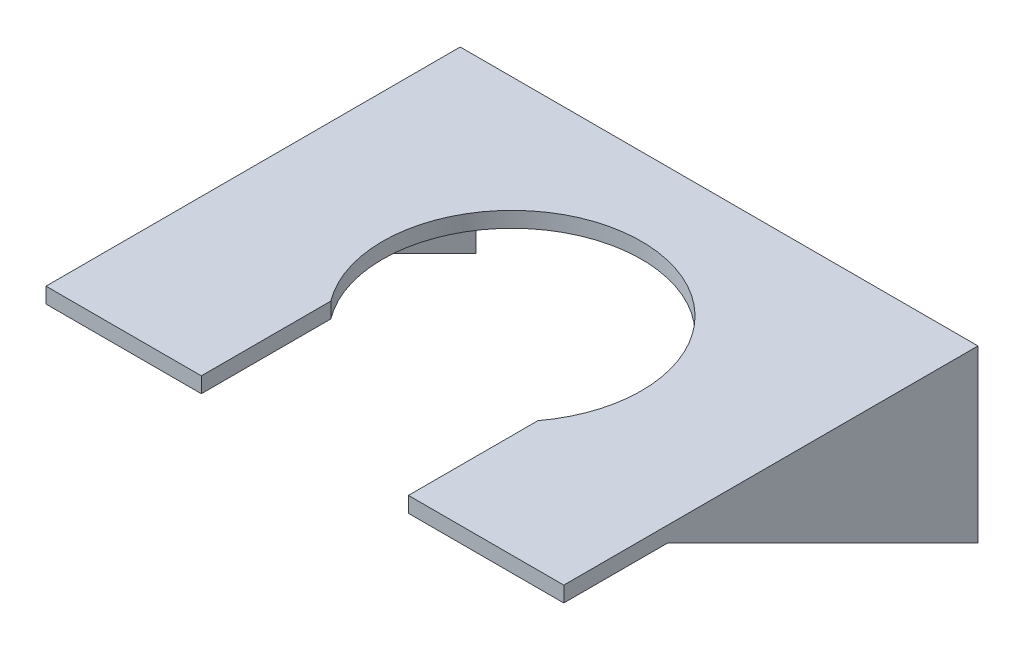
from build123d import *

# Parameters (mm, degrees)
SKETCH1_W           = 50
SKETCH1_H           = 1.5
BOSS_EXTRUDE1_DEPTH = 40
CUT_EXTRUDE1_DEPTH  = 1.5
BOSS_EXTRUDE2_DEPTH = 1.5


with BuildPart() as part:
    # Sketch1 → Boss-Extrude1 (new body)
    with BuildSketch(Plane.XY):
        with Locations((0, -1.811768481)):
            Rectangle(SKETCH1_W, SKETCH1_H)
    extrude(amount=BOSS_EXTRUDE1_DEPTH)

    # Sketch2 → Cut-Extrude1 (cut)
    with BuildSketch(Plane(origin=(0, -1.061768481, 0), x_dir=(1, 0, 0), z_dir=(0, 1, 0))):
        with BuildLine():
            Line((-10, -27.5), (-10, -40))
            Line((-10, -40), (10, -40))
            Line((10, -40), (10, -27.5))
            ThreePointArc((10, -27.5), (0, -7.5), (-10, -27.5))
        make_face()
    extrude(amount=-CUT_EXTRUDE1_DEPTH, mode=Mode.SUBTRACT)

    # Sketch4 → Boss-Extrude2 (add)
    with BuildSketch(Plane.ZY.offset(25)):
        Polygon((0, -2.561768481), (0, -17.561768481), (30, -2.561768481), align=None)
    boss_extrude2 = extrude(amount=-BOSS_EXTRUDE2_DEPTH)

    # Mirror1: Boss-Extrude2 across plane
    add(boss_extrude2.mirror(Plane(origin=(0, 0, 0), x_dir=(0, 0, 1), z_dir=(1, 0, 0))))


solid = part.part
